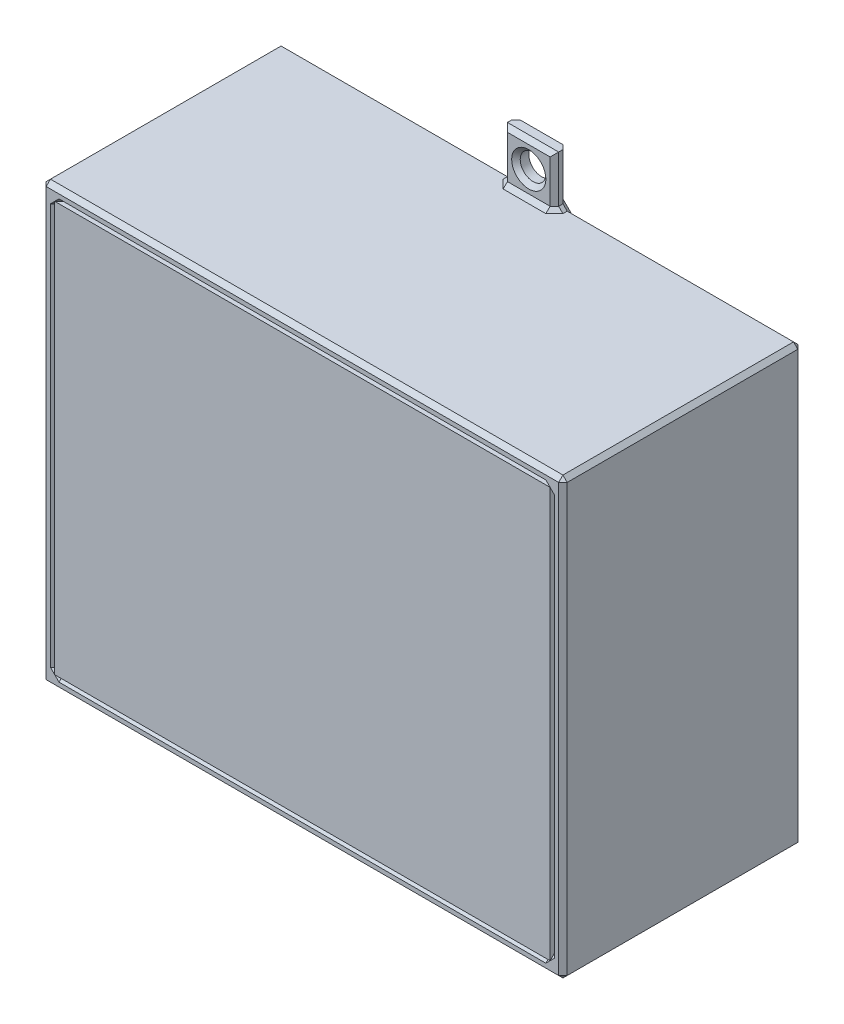
from build123d import *

# Parameters (mm, degrees)
SKETCH_1_W          = 116
SKETCH_1_H          = 96
EXTRUDE_1_DEPTH     = 3
EXTRUDE_START       = -3
SKETCH_2_W          = 122
SKETCH_2_H          = 102
SKETCH_2_W_2        = 116
SKETCH_2_H_2        = 96
EXTRUDE_2_DEPTH     = 56
SKETCH_3_W          = 30
SKETCH_3_H          = 15
CUT_EXTRUDE_1_DEPTH = 8
SKETCH_4_W          = 15
SKETCH_4_H          = 30
CUT_EXTRUDE_2_DEPTH = 3
SKETCH_5_W          = 12
SKETCH_5_H          = 12
SKETCH_5_R          = 3
EXTRUDE_6_DEPTH     = 3
CHAMFER_3_SIZE      = 1


with BuildPart() as part:
    # 草图1 → 凸台-拉伸1 (new body)
    with BuildSketch(Plane.XY):
        with Locations((50, -40)):
            Rectangle(SKETCH_1_W, SKETCH_1_H)
    extrude(amount=EXTRUDE_1_DEPTH)


with BuildPart() as body_2:
    # 草图2 → 凸台-拉伸2 (new body)
    with BuildSketch(Plane(origin=(0, 0, 0), x_dir=(-1, 0, 0), z_dir=(0, 0, -1)).offset(EXTRUDE_START)):
        with Locations((-50, -40)):
            Rectangle(SKETCH_2_W, SKETCH_2_H)
        with Locations((-50, -40)):
            Rectangle(SKETCH_2_W_2, SKETCH_2_H_2, mode=Mode.SUBTRACT)
    extrude(amount=EXTRUDE_2_DEPTH)

    # 草图3 → 切除-拉伸1 (cut)
    with BuildSketch(Plane.XZ.offset(91)):
        with Locations((50, -7.5)):
            Rectangle(SKETCH_3_W, SKETCH_3_H)
    extrude(amount=-CUT_EXTRUDE_1_DEPTH, mode=Mode.SUBTRACT)

    # 草图4 → 切除-拉伸2 (cut)
    with BuildSketch(Plane.ZY.offset(11)):
        with Locations((-7.5, -40)):
            Rectangle(SKETCH_4_W, SKETCH_4_H)
    extrude(amount=-CUT_EXTRUDE_2_DEPTH, mode=Mode.SUBTRACT)

    # 草图5 → 凸台-拉伸6 (add)
    with BuildSketch(Plane(origin=(0, 0, -53), x_dir=(-1, 0, 0), z_dir=(0, 0, -1))):
        with Locations((-50, 17)):
            Rectangle(SKETCH_5_W, SKETCH_5_H)
        with Locations((-50, 17)):
            Circle(SKETCH_5_R, mode=Mode.SUBTRACT)
    extrude(amount=-EXTRUDE_6_DEPTH)

    # 倒角3
    chamfer_3_edges = [body_2.edges().sort_by_distance(p)[0] for p in [
        (-11, -40, 3),
        (50, -91, 3),
        (111, -40, 3),
        (50, 11, 3),
        (-11, -40, -53),
        (50, -88, 3),
        (-11, -91, -25),
        (-8, -40, 3),
        (50, 8, 3),
        (108, -40, 3),
        (83.5, 11, -53),
        (-11, 11, -25),
        (111, -40, -53),
        (111, 11, -25),
        (50, -91, -53),
        (111, -91, -25),
        (50, -88, -15),
        (65, -88, -7.5),
        (-8, 8, -25),
        (50, -88, 0),
        (35, -88, -7.5),
        (108, 8, -25),
        (108, -88, -25),
        (-8, -88, -25),
        (-8, -40, -53),
        (50, -88, -53),
        (35, -91, -7.5),
        (50, -91, -15),
        (108, -40, -53),
        (65, -91, -7.5),
        (50, -91, 0),
        (50, 8, -53),
        (-8, -40, 0),
        (-8, -55, -7.5),
        (-8, -40, -15),
        (-8, -25, -7.5),
        (-11, -40, 0),
        (-11, -25, -7.5),
        (-11, -40, -15),
        (-11, -55, -7.5),
        (16.5, 11, -53),
        (44, 17, -50),
        (50, 11, -50),
        (44, 11, -51.5),
        (56, 17, -50),
        (56, 11, -51.5),
        (50, 23, -50),
        (53, 17, -50),
        (44, 17, -53),
        (56, 17, -53),
    ]]
    chamfer(chamfer_3_edges, length=CHAMFER_3_SIZE)


solid = Compound([part.part, body_2.part])
